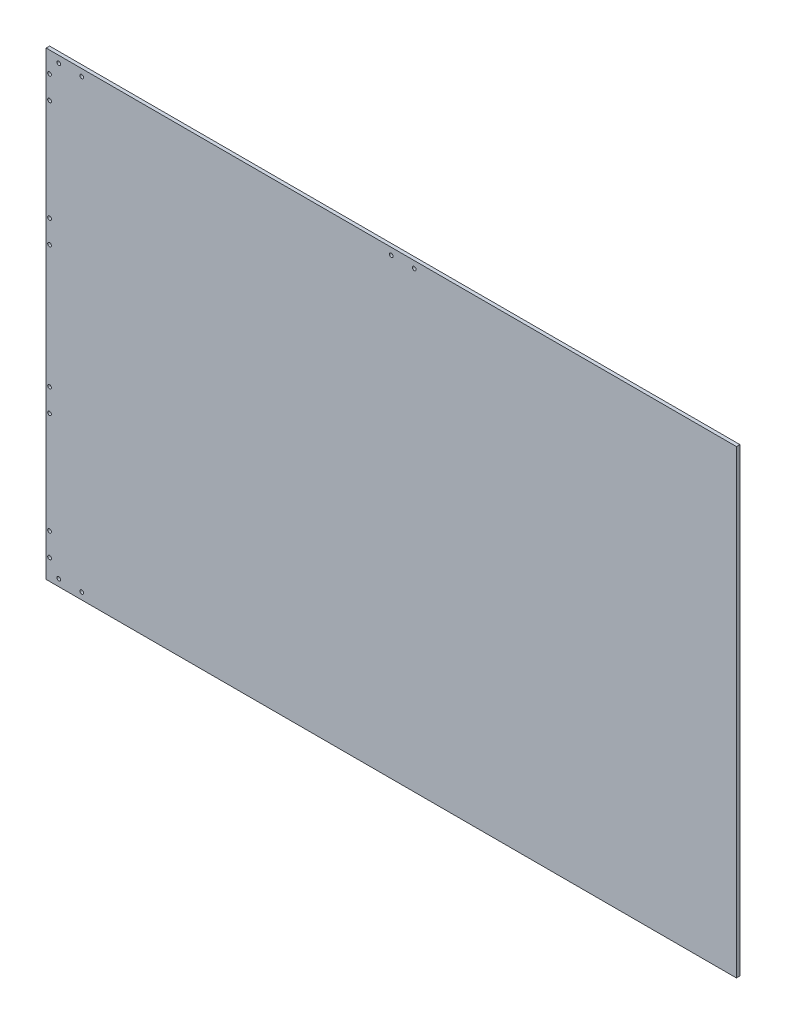
from build123d import *

# Parameters (mm, degrees)
SKETCH_1_W          = 600
SKETCH_1_H          = 400
EXTRUDE_1_DEPTH     = 3
SKETCH_3_R          = 1.6
CUT_EXTRUDE_1_DEPTH = 361.567608085
SKETCH_4_R          = 1.6
CUT_EXTRUDE_2_DEPTH = 361.567608085
SKETCH_5_R          = 1.6
CUT_EXTRUDE_3_DEPTH = 361.567608085


with BuildPart() as part:
    # 草图1 → 凸台-拉伸1 (new body)
    with BuildSketch(Plane.XY):
        Rectangle(SKETCH_1_W, SKETCH_1_H)
    extrude(amount=EXTRUDE_1_DEPTH)

    # 草图3 → 切除-拉伸1 (cut, through all)
    with BuildSketch(Plane(origin=(0, 0, 0), x_dir=(-1, 0, 0), z_dir=(0, 0, -1))):
        with Locations((269, -194)):
            Circle(SKETCH_3_R)
        with Locations((289, -194)):
            Circle(SKETCH_3_R)
        with Locations((297, -182)):
            Circle(SKETCH_3_R)
        with Locations((297, -162)):
            Circle(SKETCH_3_R)
        with Locations((297, 162)):
            Circle(SKETCH_3_R)
        with Locations((297, 182)):
            Circle(SKETCH_3_R)
        with Locations((289, 194)):
            Circle(SKETCH_3_R)
        with Locations((269, 194)):
            Circle(SKETCH_3_R)
    extrude(amount=-CUT_EXTRUDE_1_DEPTH, mode=Mode.SUBTRACT)

    # 草图4 → 切除-拉伸2 (cut, through all)
    with BuildSketch(Plane(origin=(0, 0, 0), x_dir=(-1, 0, 0), z_dir=(0, 0, -1))):
        with Locations((0, 194)):
            Circle(SKETCH_4_R)
        with Locations((-20, 194)):
            Circle(SKETCH_4_R)
    extrude(amount=-CUT_EXTRUDE_2_DEPTH, mode=Mode.SUBTRACT)

    # 草图5 → 切除-拉伸3 (cut, through all)
    with BuildSketch(Plane.XY.offset(3)):
        with Locations((-297, 73.5)):
            Circle(SKETCH_5_R)
        with Locations((-297, 53.5)):
            Circle(SKETCH_5_R)
        with Locations((-297, -53.5)):
            Circle(SKETCH_5_R)
        with Locations((-297, -73.5)):
            Circle(SKETCH_5_R)
    extrude(amount=-CUT_EXTRUDE_3_DEPTH, mode=Mode.SUBTRACT)


solid = part.part
